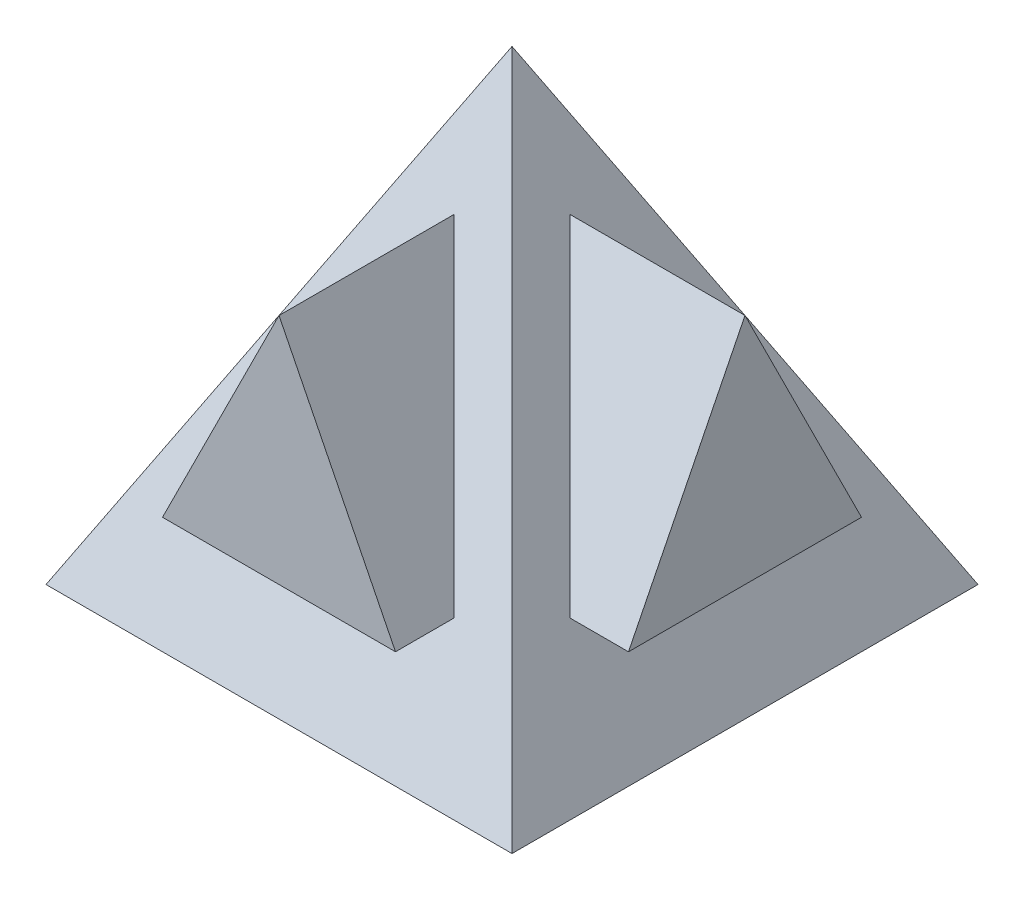
from build123d import *

# Parameters (mm, degrees)
BOSS_EXTRUDE1_DEPTH   = 101.6
BODY_MOVE_COPY2_ANGLE = 90


with BuildPart() as part:
    # Sketch2 → Loft2 section 0
    with BuildSketch(Plane(origin=(0, 0, 0), x_dir=(1, 0, 0), z_dir=(0, 1, 0)), mode=Mode.PRIVATE) as loft2_s0:
        with BuildLine():
            Line((101.6, -101.6), (-101.6, -101.6))
            Line((-101.6, -101.6), (-101.6, 101.6))
            Line((-101.6, 101.6), (101.6, 101.6))
            Line((101.6, 101.6), (101.6, -101.6))
        make_face()
    loft([Vertex(0, 203.2, 0), loft2_s0.sketch])


with BuildPart() as body_2:
    # Sketch5 → Boss-Extrude1 (new body)
    with BuildSketch(Plane(origin=(0, 21.452394789, 0), x_dir=(1, 0, 0), z_dir=(0, 0, 1))):
        Polygon((0, 130.947605211), (-50.8, 29.347605211), (50.8, 29.347605211), align=None)
    extrude(amount=BOSS_EXTRUDE1_DEPTH)


with BuildPart() as body_3:
    # Body-Move/Copy2: copy of body 2
    add(body_2.part.rotate(Axis((0, 0, 0), (0, 1, 0)), BODY_MOVE_COPY2_ANGLE))


with BuildPart() as part_1:
    add(part.part)

    # Combine1: union body 2, body 3
    add(body_2.part)
    add(body_3.part)


solid = part_1.part
